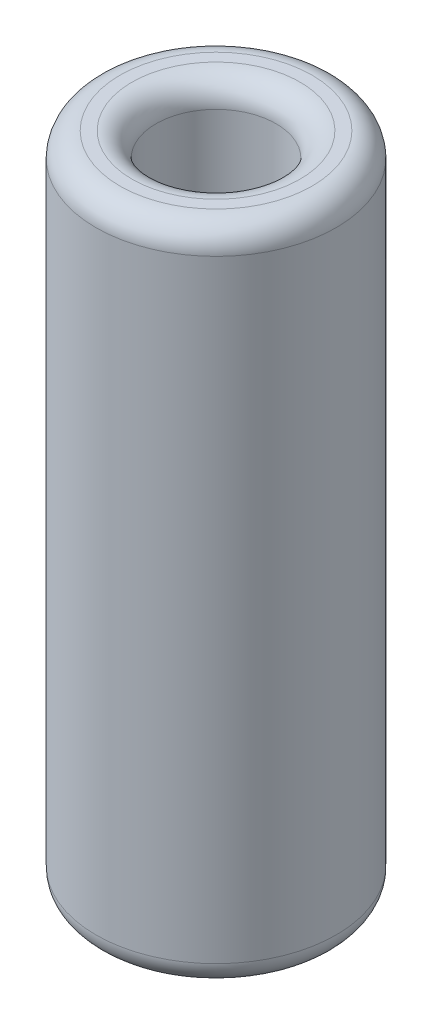
from build123d import *

# Parameters (mm, degrees)
SKETCH1_R           = 12.7
SKETCH1_R_2         = 6.35
BOSS_EXTRUDE1_DEPTH = 34.925
FILLET1_R           = 2.54


with BuildPart() as part:
    # Sketch1 → Boss-Extrude1 (new, symmetric)
    with BuildSketch(Plane(origin=(0, 0, 0), x_dir=(1, 0, 0), z_dir=(0, 1, 0))):
        with Locations(Location((0, 0, 0), (0, 0, 270))):
            Circle(SKETCH1_R)
        with Locations(Location((0, 0, 0), (0, 0, 270))):
            Circle(SKETCH1_R_2, mode=Mode.SUBTRACT)
    extrude(amount=BOSS_EXTRUDE1_DEPTH, both=True)

    # Fillet1
    fillet1_edges = [part.edges().sort_by_distance(p)[0] for p in [
        (0, -34.925, -12.7),
        (0, 34.925, -12.7),
        (0, -34.925, -6.35),
        (0, 34.925, -6.35),
    ]]
    fillet(fillet1_edges, radius=FILLET1_R)


solid = part.part
